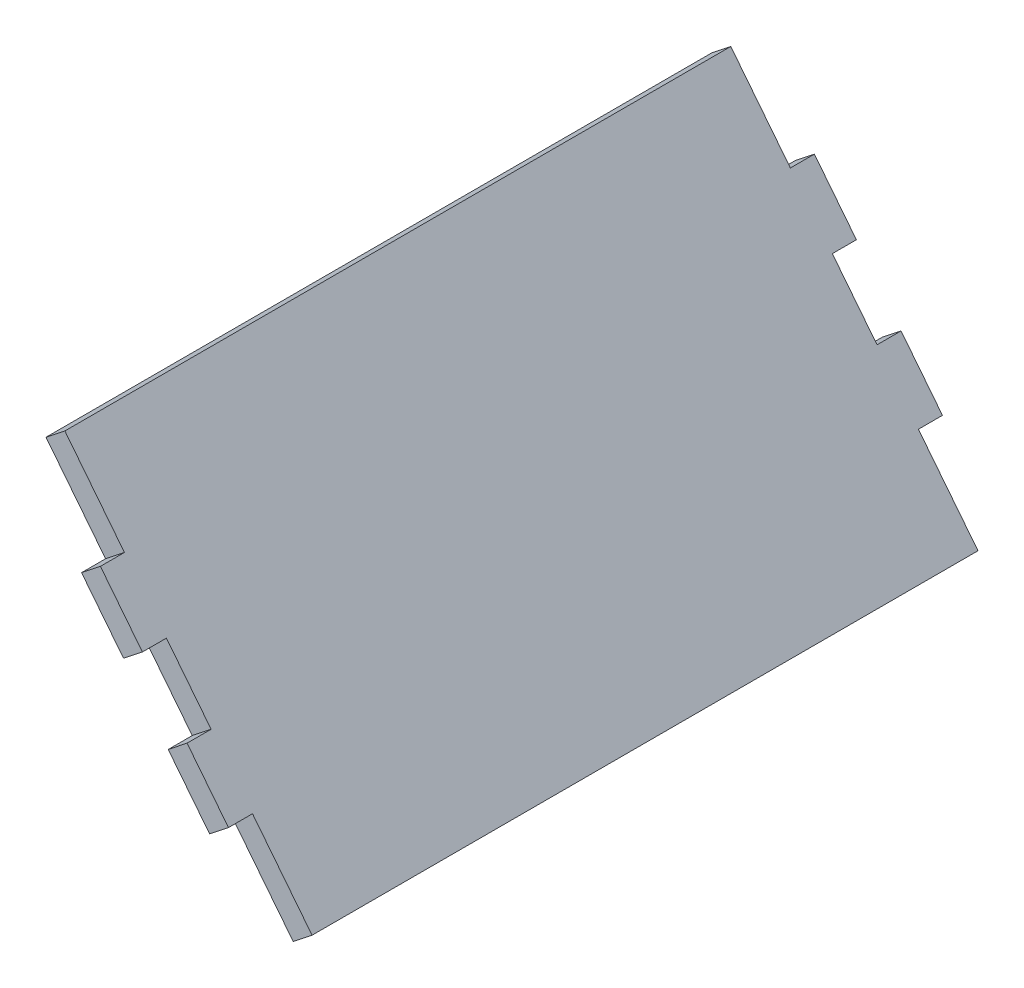
from build123d import *

# Parameters (mm, degrees)
BOSS_EXTRUDE1_DEPTH = 94.322511
SKETCH2_W           = 3.175
SKETCH2_H           = 12.7
SKETCH2_H_2         = 9.525
CUT_EXTRUDE1_DEPTH  = 146.131101822


with BuildPart() as part:
    # Sketch1 → Boss-Extrude1 (new body)
    with BuildSketch(Plane.XY):
        Polygon((-57.559752251, 25.95051887), (-90.217961646, 67.317584104), (-92.709964426, 65.350213488), (-60.051755031, 23.983148254), align=None)
    extrude(amount=-BOSS_EXTRUDE1_DEPTH)

    # Sketch2 → Cut-Extrude1 (cut, through all)
    with BuildSketch(Plane(origin=(-22.838178642, -18.030141034, 0), x_dir=(0, 0, -1), z_dir=(0.7848827655333936, 0.6196442885790622, 0))):
        with Locations((92.735011379, 102.389456242)):
            Rectangle(SKETCH2_W, SKETCH2_H)
        with Locations((92.735011379, 82.323686752)):
            Rectangle(SKETCH2_W, SKETCH2_H_2)
        with Locations((92.735011379, 62.384686752)):
            Rectangle(SKETCH2_W, SKETCH2_H)
        with Locations((1.5875, 102.389456242)):
            Rectangle(SKETCH2_W, SKETCH2_H)
        with Locations((1.5875, 82.323686752)):
            Rectangle(SKETCH2_W, SKETCH2_H_2)
        with Locations((1.5875, 62.384686752)):
            Rectangle(SKETCH2_W, SKETCH2_H)
    extrude(amount=-CUT_EXTRUDE1_DEPTH, mode=Mode.SUBTRACT)


solid = part.part
